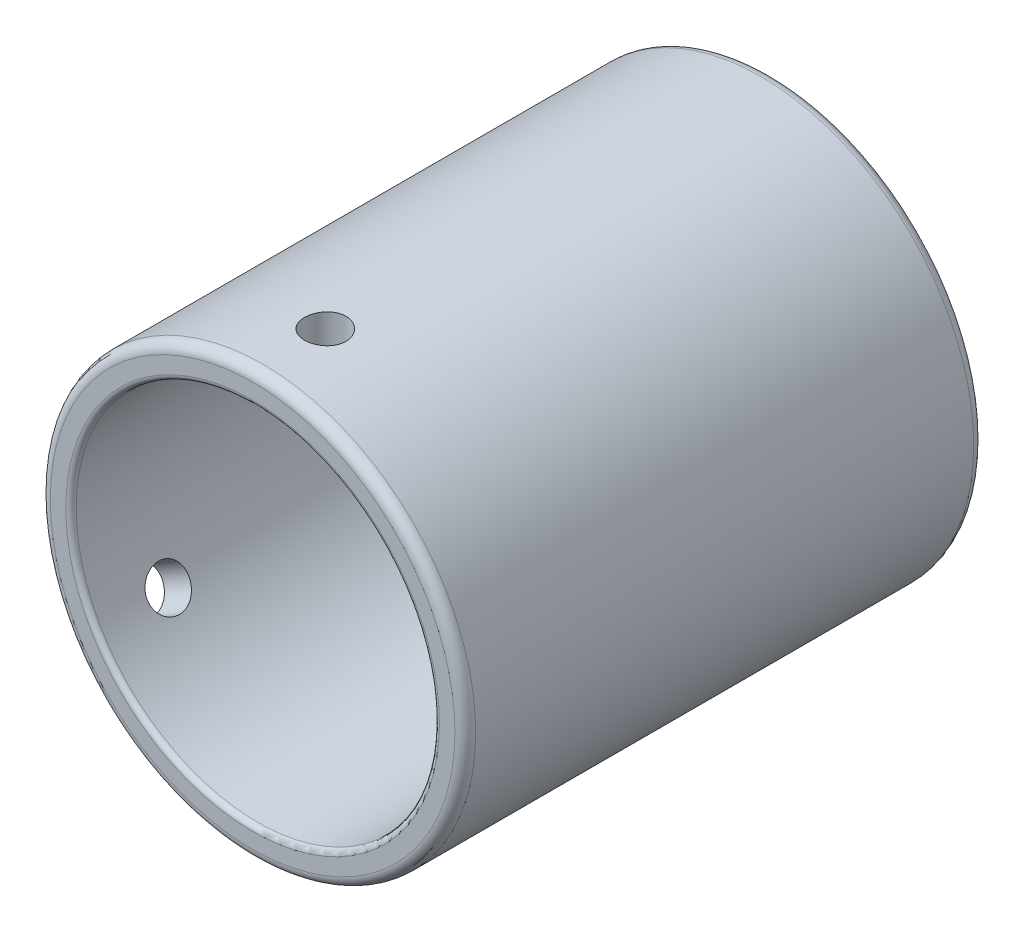
from build123d import *

# Parameters (mm, degrees)
BOSS_EXTRUDE1_DEPTH      = 30
BOSS_EXTRUDE1_DEPTH_BACK = 20
SKETCH1_R                = 20.5
SKETCH1_R_2              = 17.5
SKETCH3_R                = 2
CUT_EXTRUDE1_DEPTH       = 42.71930009
CIRPATTERN1_COUNT        = 2
CIRPATTERN1_ANGLE        = 120
FILLET1_R                = 1
FILLET2_R                = 0.5


with BuildPart() as part:
    # Sketch1 → Boss-Extrude1 (new, two sides: drawn at the far end of the back side and taken through both)
    with BuildSketch(Plane.XY.offset(-BOSS_EXTRUDE1_DEPTH_BACK)):
        Circle(SKETCH1_R)
        Circle(SKETCH1_R_2, mode=Mode.SUBTRACT)
    extrude(amount=BOSS_EXTRUDE1_DEPTH + BOSS_EXTRUDE1_DEPTH_BACK)

    # Sketch3 → Cut-Extrude1 (cut, through all)
    with BuildSketch(Plane(origin=(0, 0, 0), x_dir=(1, 0, 0), z_dir=(0, 1, 0))):
        with Locations(Location((0, -23, 0), (0, 0, 90))):
            Circle(SKETCH3_R)
    cut_extrude1 = extrude(amount=CUT_EXTRUDE1_DEPTH, mode=Mode.SUBTRACT)

    # CirPattern1: Cut-Extrude1 ×2 about axis
    cirpattern1_axis = Axis((0, 0, -20), (0, 0, 1))
    for i in range(1, CIRPATTERN1_COUNT):
        add(cut_extrude1.rotate(cirpattern1_axis, i * CIRPATTERN1_ANGLE / (CIRPATTERN1_COUNT - 1)), mode=Mode.SUBTRACT)

    # Fillet1
    fillet1_edges = [part.edges().sort_by_distance(p)[0] for p in [
        (-20.5, 0, -20),
        (-20.5, 0, 30),
    ]]
    fillet(fillet1_edges, radius=FILLET1_R)

    # Fillet2
    fillet2_edges = [part.edges().sort_by_distance(p)[0] for p in [
        (-17.5, 0, -20),
        (-17.5, 0, 30),
    ]]
    fillet(fillet2_edges, radius=FILLET2_R)


solid = part.part
